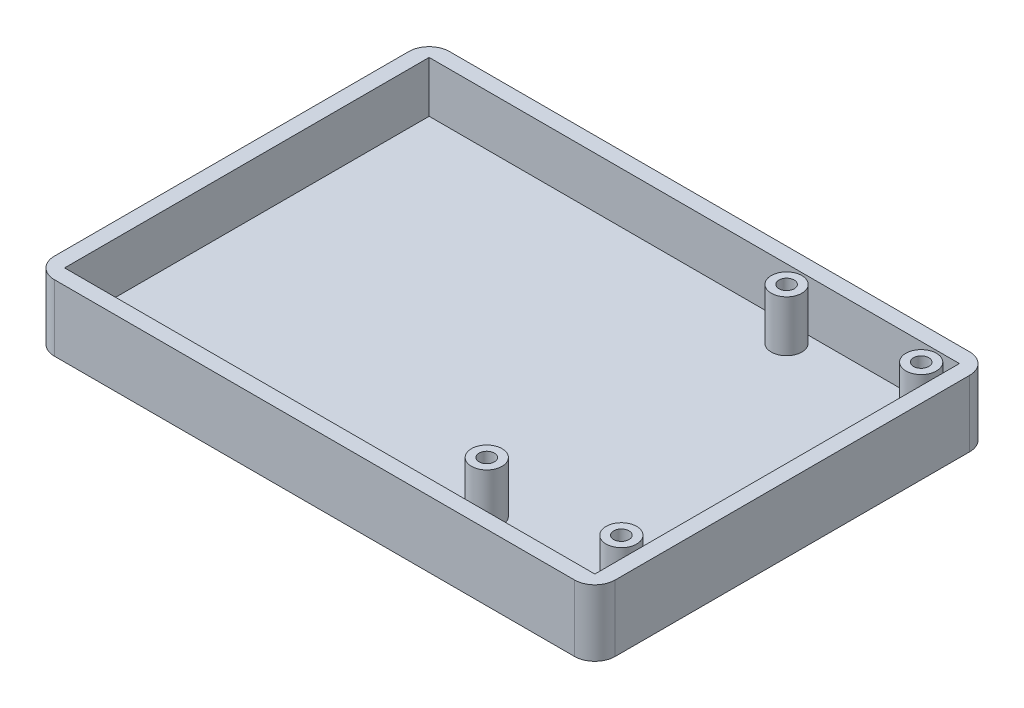
from build123d import *

# Parameters (mm, degrees)
SKETCH1_W             = 110
SKETCH1_H             = 77.5
SKETCH1_W_2           = 104
SKETCH1_H_2           = 71.5
BOSS_EXTRUDE1_DEPTH   = 10
SKETCH1_R             = 3
SKETCH1_R_2           = 1.5
BOSS_EXTRUDE1_2_DEPTH = 10
BOSS_EXTRUDE1_3_DEPTH = 10
BOSS_EXTRUDE1_4_DEPTH = 10
BOSS_EXTRUDE1_5_DEPTH = 10
SKETCH1_2_W           = 110
SKETCH1_2_H           = 77.5
BOSS_EXTRUDE2_DEPTH   = 3
FILLET1_R             = 4


with BuildPart() as part:
    # Sketch1 → Boss-Extrude1 (new body)
    with BuildSketch(Plane(origin=(0, 0, 0), x_dir=(1, 0, 0), z_dir=(0, 1, 0))):
        with Locations((55, 38.75)):
            Rectangle(SKETCH1_W, SKETCH1_H)
        with Locations((55, 38.75)):
            Rectangle(SKETCH1_W_2, SKETCH1_H_2, mode=Mode.SUBTRACT)
    extrude(amount=BOSS_EXTRUDE1_DEPTH)

    # Sketch1<2> → Boss-Extrude2 (add)
    with BuildSketch(Plane(origin=(0, 0, 0), x_dir=(1, 0, 0), z_dir=(0, 1, 0))):
        with Locations((55, 38.75)):
            Rectangle(SKETCH1_2_W, SKETCH1_2_H)
    extrude(amount=-BOSS_EXTRUDE2_DEPTH)

    # Fillet1
    fillet1_edges = [part.edges().sort_by_distance(p)[0] for p in [
        (0, 3.5, -77.5),
        (0, 3.5, 0),
        (110, 3.5, -77.5),
        (110, 3.5, 0),
    ]]
    fillet(fillet1_edges, radius=FILLET1_R)


with BuildPart() as body_2:
    # Sketch1 → Boss-Extrude1 2 (new body)
    with BuildSketch(Plane(origin=(0, 0, 0), x_dir=(1, 0, 0), z_dir=(0, 1, 0))):
        with Locations((76.6, 12.2)):
            Circle(SKETCH1_R)
        with Locations((76.6, 12.2)):
            Circle(SKETCH1_R_2, mode=Mode.SUBTRACT)
    extrude(amount=BOSS_EXTRUDE1_2_DEPTH)


with BuildPart() as body_3:
    # Sketch1 → Boss-Extrude1 3 (new body)
    with BuildSketch(Plane(origin=(0, 0, 0), x_dir=(1, 0, 0), z_dir=(0, 1, 0))):
        with Locations((103, 12.2)):
            Circle(SKETCH1_R)
        with Locations((103, 12.2)):
            Circle(SKETCH1_R_2, mode=Mode.SUBTRACT)
    extrude(amount=BOSS_EXTRUDE1_3_DEPTH)


with BuildPart() as body_4:
    # Sketch1 → Boss-Extrude1 4 (new body)
    with BuildSketch(Plane(origin=(0, 0, 0), x_dir=(1, 0, 0), z_dir=(0, 1, 0))):
        with Locations((103, 71)):
            Circle(SKETCH1_R)
        with Locations((103, 71)):
            Circle(SKETCH1_R_2, mode=Mode.SUBTRACT)
    extrude(amount=BOSS_EXTRUDE1_4_DEPTH)


with BuildPart() as body_5:
    # Sketch1 → Boss-Extrude1 5 (new body)
    with BuildSketch(Plane(origin=(0, 0, 0), x_dir=(1, 0, 0), z_dir=(0, 1, 0))):
        with Locations((76.6, 71)):
            Circle(SKETCH1_R)
        with Locations((76.6, 71)):
            Circle(SKETCH1_R_2, mode=Mode.SUBTRACT)
    extrude(amount=BOSS_EXTRUDE1_5_DEPTH)


solid = Compound([part.part, body_2.part, body_3.part, body_4.part, body_5.part])
